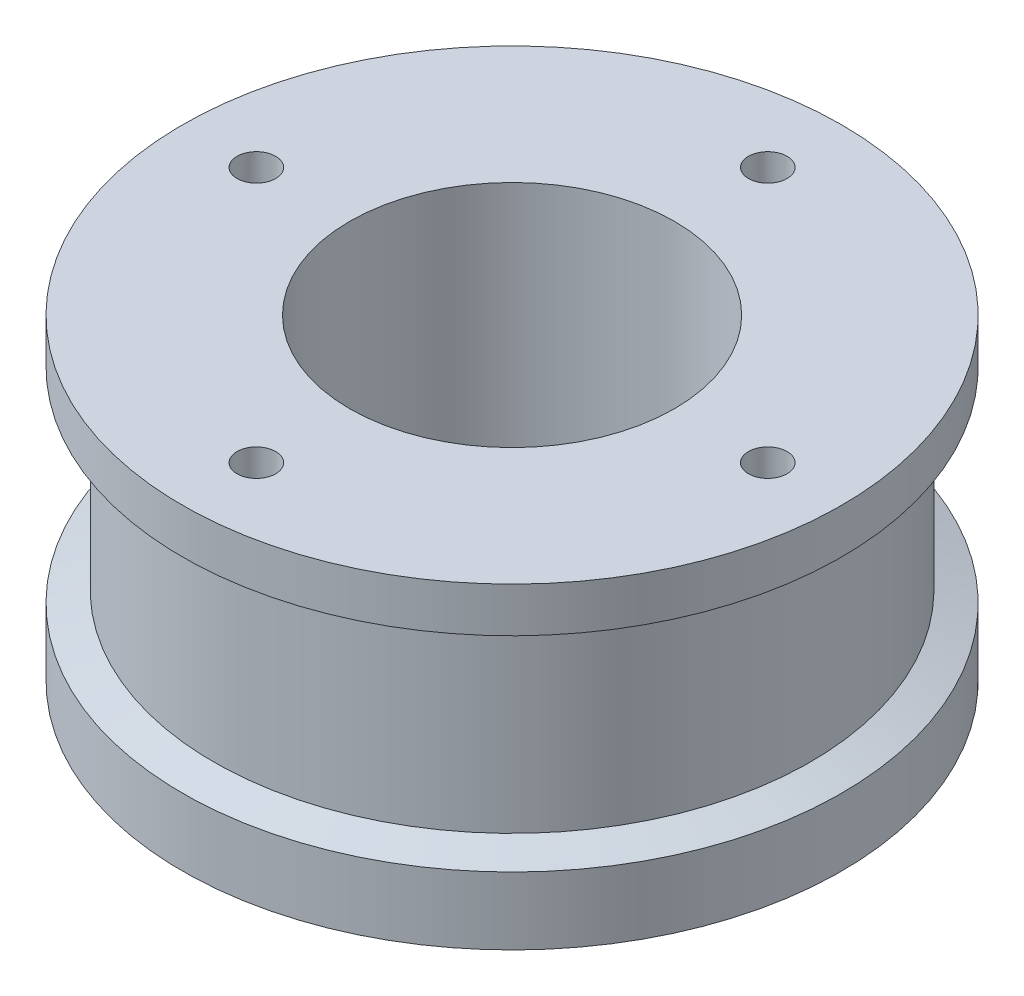
from build123d import *

# Parameters (mm, degrees)
CBORE_FOR_M3_SBHCS1_D           = 3.4
CBORE_FOR_M3_SBHCS1_CBORE_D     = 6.7
CBORE_FOR_M3_SBHCS1_CBORE_DEPTH = 2.15
F_0_257_DIAMETER_HOLE1_D        = 6.5278
F_0_257_DIAMETER_HOLE1_DEPTH    = 6.35
F_0_257_DIAMETER_HOLE1_TIP      = 1.961148974


with BuildPart() as part:
    # Sketch1 → Revolve1 (revolve)
    with BuildSketch(Plane.XY, mode=Mode.PRIVATE) as revolve1_sk:
        Polygon((14.2875, 27.8791), (29, 27.8791), (29, 23.940468144), (26.25, 22.93955), (26.25, 6.93955), (29, 5.938631856), (29, 0), (14.2875, 0), align=None)
    revolve(revolve1_sk.sketch.rotate(Axis((0, 0, 0), (0, 1, 0)), 90), axis=Axis((0, 0, 0), (0, 1, 0)))

    # CBORE for M3 SBHCS1 (through all)
    with Locations(Plane.XZ):
        with Locations((0, 22.5), (0, -22.5), (22.5, 0), (-22.5, 0)):
            CounterBoreHole(CBORE_FOR_M3_SBHCS1_D / 2, CBORE_FOR_M3_SBHCS1_CBORE_D / 2, CBORE_FOR_M3_SBHCS1_CBORE_DEPTH)

    # F (0.257) Diameter Hole1
    with Locations(Plane.XZ):
        with Locations((-11.90625, 20.622229928), (-11.90625, -20.622229928), (11.90625, -20.622229928), (11.90625, 20.622229928)):
            Hole(F_0_257_DIAMETER_HOLE1_D / 2, depth=F_0_257_DIAMETER_HOLE1_DEPTH)
            with Locations((0, 0, -(F_0_257_DIAMETER_HOLE1_DEPTH + F_0_257_DIAMETER_HOLE1_TIP / 2))):  # 118° drill point
                Cone(0, F_0_257_DIAMETER_HOLE1_D / 2, F_0_257_DIAMETER_HOLE1_TIP, mode=Mode.SUBTRACT)


solid = part.part
